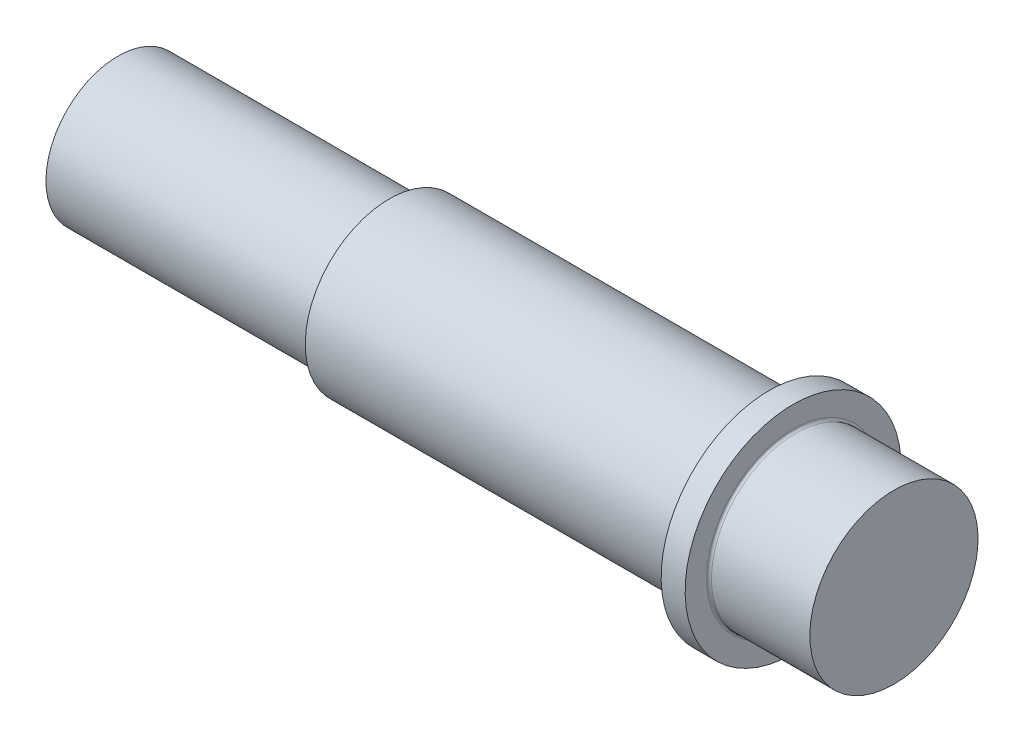
from build123d import *

# Parameters (mm, degrees)
FILLET1_R = 0.5


with BuildPart() as part:
    # Sketch1 → Revolve1 (revolve)
    with BuildSketch(Plane.XY, mode=Mode.PRIVATE) as revolve1_sk:
        Polygon((-80.816688046, 15.015), (-37.316688046, 15.015), (-24.316688046, 15.015), (-24.316688046, 17.5), (27.280476237, 17.5), (54.816688046, 17.5), (54.816688046, 22.5), (59.816688046, 22.5), (59.816688046, 17.5175), (80.816688046, 17.5175), (80.816688046, 0), (-80.816688046, 0), align=None)
    revolve(revolve1_sk.sketch.rotate(Axis((-91.454349808, 0, 0), (1, 0, 0)), 180), axis=Axis((-91.454349808, 0, 0), (1, 0, 0)))

    # Fillet1
    fillet1_edges = [part.edges().sort_by_distance(p)[0] for p in [
        (-24.316688046, 15.015, 0),
        (54.816688046, 17.5, 0),
        (59.816688046, 17.5175, 0),
    ]]
    fillet(fillet1_edges, radius=FILLET1_R)


solid = part.part
